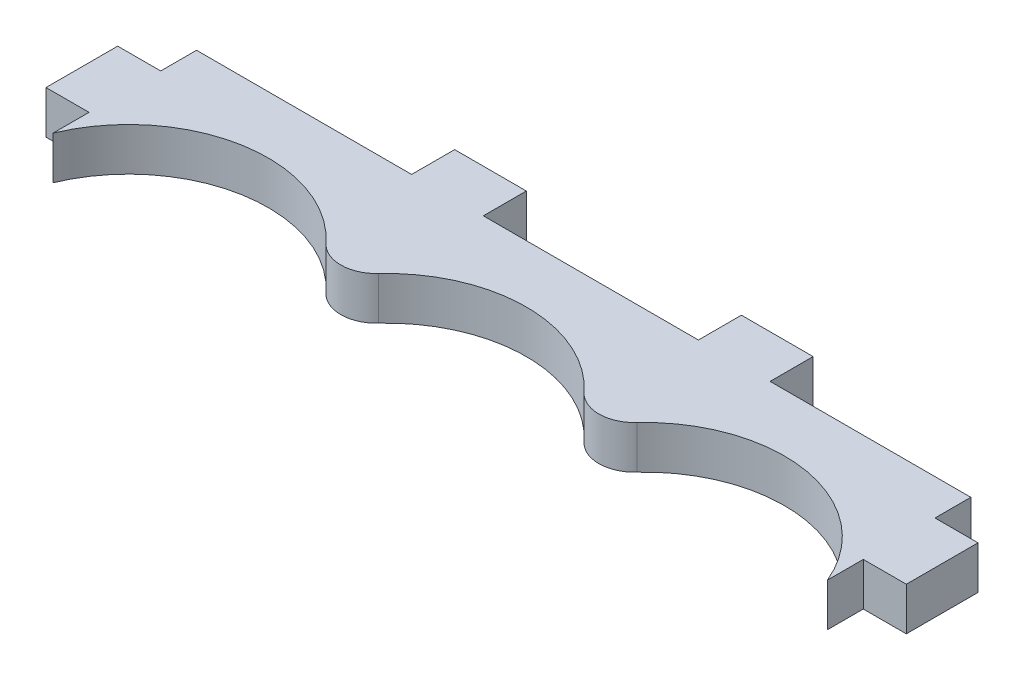
from build123d import *

# Parameters (mm, degrees)
BOSS_EXTRUDE1_DEPTH = 6
FILLET1_R           = 5


with BuildPart() as part:
    # Sketch1 → Boss-Extrude1 (new body)
    with BuildSketch(Plane(origin=(0, 0, 0), x_dir=(1, 0, 0), z_dir=(0, 1, 0))):
        with BuildLine():
            Line((0, 0), (30, 0))
            Line((30, 0), (30, 6))
            Line((30, 6), (40, 6))
            Line((40, 6), (40, 0))
            Line((40, 0), (70, 0))
            Line((70, 0), (70, 6))
            Line((70, 6), (80, 6))
            Line((80, 6), (80, 0))
            Line((80, 0), (108, 0))
            Line((108, 0), (108, -5))
            Line((108, -5), (114, -5))
            Line((114, -5), (114, -15))
            Line((114, -15), (108, -15))
            Line((108, -15), (108, -20))
            ThreePointArc((108, -20), (90, -8), (72, -20))
            ThreePointArc((72, -20), (54, -8), (36, -20))
            ThreePointArc((36, -20), (18, -8), (0, -20))
            Line((0, -20), (0, -15))
            Line((0, -15), (-6, -15))
            Line((-6, -15), (-6, -5))
            Line((-6, -5), (0, -5))
            Line((0, -5), (0, 0))
        make_face()
    extrude(amount=BOSS_EXTRUDE1_DEPTH)

    # Fillet1
    fillet1_edges = [part.edges().sort_by_distance(p)[0] for p in [
        (72, 3, 20),
        (36, 3, 20),
    ]]
    fillet(fillet1_edges, radius=FILLET1_R)


solid = part.part
